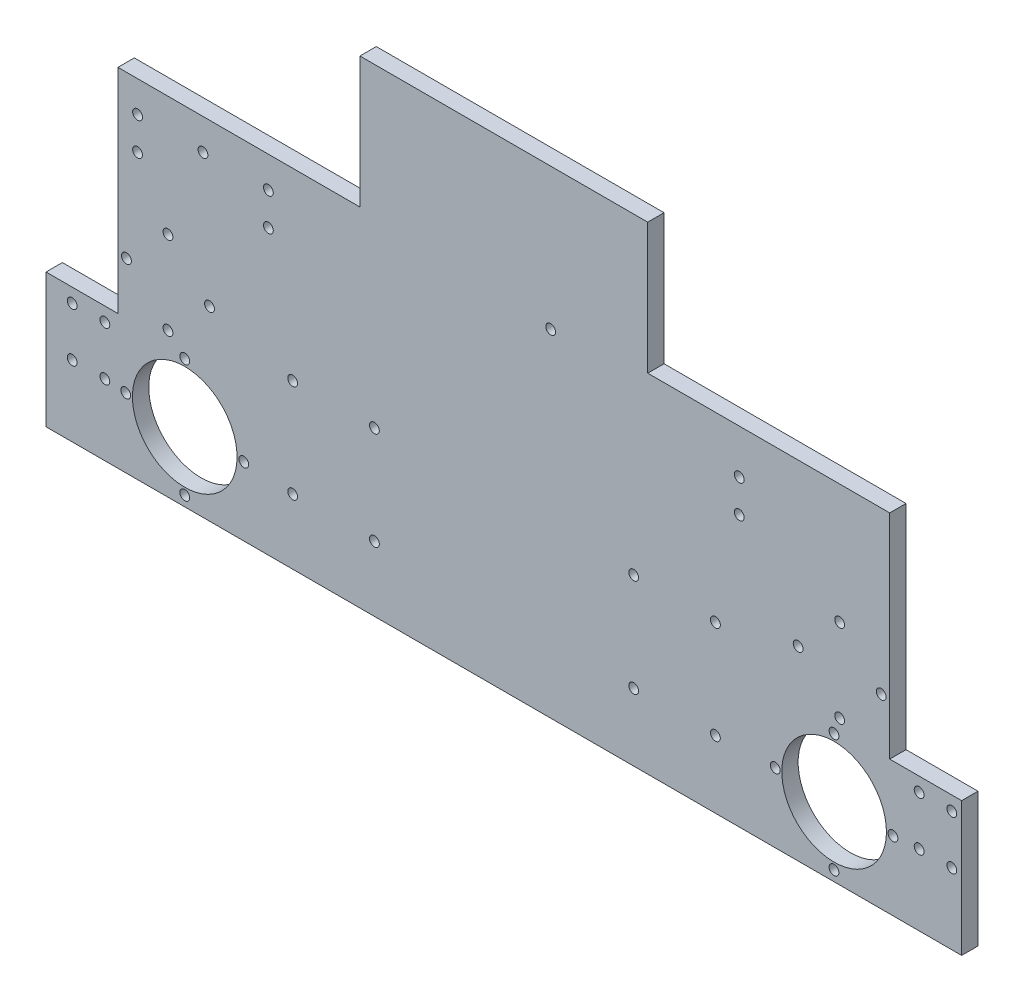
from build123d import *

# Parameters (mm, degrees)
BOSS_EXTRU_2_DEPTH       = 5
ESQUISSE2_R              = 1.5
ENL_V_MAT_EXTRU_1_DEPTH  = 14
ESQUISSE3_R              = 1.5
ENL_V_MAT_EXTRU_2_DEPTH  = 32
ESQUISSE4_R              = 1.5
ENL_V_MAT_EXTRU_3_DEPTH  = 293.72553698
ESQUISSE5_R              = 1.500580152
ENL_V_MAT_EXTRU_4_DEPTH  = 293.72553698
ESQUISSE6_R              = 1.5
ENL_V_MAT_EXTRU_5_DEPTH  = 293.72553698
ESQUISSE7_R              = 1.5
ENL_V_MAT_EXTRU_6_DEPTH  = 293.72553698
ESQUISSE8_W              = 88
ESQUISSE8_H              = 33
ENL_V_MAT_EXTRU_7_DEPTH  = 293.72553698
ESQUISSE9_R              = 1.5
ESQUISSE9_R_2            = 1.507357215
ENL_V_MAT_EXTRU_8_DEPTH  = 279.668333328
ESQUISSE10_W             = 280
ESQUISSE10_H             = 4
BOSS_EXTRU_3_DEPTH       = 5
ESQUISSE12_R             = 16
ENL_V_MAT_EXTRU_10_DEPTH = 279.668333328
ESQUISSE13_R             = 1.5
ENL_V_MAT_EXTRU_11_DEPTH = 279.668333328


with BuildPart() as part:
    # Esquisse1 → Boss.-Extru.2 (new body)
    with BuildSketch(Plane.XY):
        Polygon((-22, -37), (258, -37), (258, 0), (236, 0), (236, 65.2), (162, 65.2), (162, 138.2), (74, 138.2), (74, 65.2), (0, 65.2), (0, 0), (-22, 0), align=None)
    extrude(amount=BOSS_EXTRU_2_DEPTH)

    # Esquisse2 → Enlèv. mat.-Extru.1 (cut)
    with BuildSketch(Plane.XY.offset(5)):
        with Locations((26, 55.7)):
            Circle(ESQUISSE2_R)
        with Locations((46, 55.7)):
            Circle(ESQUISSE2_R)
        with Locations((6, 55.7)):
            Circle(ESQUISSE2_R)
        with Locations((6, 45.7)):
            Circle(ESQUISSE2_R)
        with Locations((-4, -4.3)):
            Circle(ESQUISSE2_R)
        with Locations((-14, -4.3)):
            Circle(ESQUISSE2_R)
        with Locations((-4, -19.3)):
            Circle(ESQUISSE2_R)
        with Locations((-14, -19.3)):
            Circle(ESQUISSE2_R)
    extrude(amount=-ENL_V_MAT_EXTRU_1_DEPTH, mode=Mode.SUBTRACT)

    # Esquisse3 → Enlèv. mat.-Extru.2 (cut)
    with BuildSketch(Plane.XY.offset(5)):
        with Locations((132.331204837, 62.002269793)):
            Circle(ESQUISSE3_R)
    extrude(amount=-ENL_V_MAT_EXTRU_2_DEPTH, mode=Mode.SUBTRACT)

    # Esquisse4 → Enlèv. mat.-Extru.3 (cut, through all)
    with BuildSketch(Plane(origin=(0, 0, 0), x_dir=(-1, 0, 0), z_dir=(0, 0, -1))):
        with Locations((-190, 51.7)):
            Circle(ESQUISSE4_R)
        with Locations((-190, 41.7)):
            Circle(ESQUISSE4_R)
    extrude(amount=-ENL_V_MAT_EXTRU_3_DEPTH, mode=Mode.SUBTRACT)

    # Esquisse5 → Enlèv. mat.-Extru.4 (cut, through all)
    with BuildSketch(Plane.XY.offset(5)):
        with Locations((46, 45.7)):
            Circle(ESQUISSE5_R)
    extrude(amount=-ENL_V_MAT_EXTRU_4_DEPTH, mode=Mode.SUBTRACT)

    # Esquisse6 → Enlèv. mat.-Extru.5 (cut, through all)
    with BuildSketch(Plane.XY.offset(5)):
        with Locations((245, -4.3)):
            Circle(ESQUISSE6_R)
        with Locations((255, -4.3)):
            Circle(ESQUISSE6_R)
        with Locations((255, -19.3)):
            Circle(ESQUISSE6_R)
        with Locations((245, -19.3)):
            Circle(ESQUISSE6_R)
    extrude(amount=-ENL_V_MAT_EXTRU_5_DEPTH, mode=Mode.SUBTRACT)

    # Esquisse7 → Enlèv. mat.-Extru.6 (cut, through all)
    with BuildSketch(Plane(origin=(0, 0, 0), x_dir=(-1, 0, 0), z_dir=(0, 0, -1))):
        with Locations((-15.3, 28.6)):
            Circle(ESQUISSE7_R)
        with Locations((-2.6, 15.9)):
            Circle(ESQUISSE7_R)
        with Locations((-15.3, 3.2)):
            Circle(ESQUISSE7_R)
        with Locations((-28, 15.9)):
            Circle(ESQUISSE7_R)
        with Locations((-208, 15.9)):
            Circle(ESQUISSE7_R)
        with Locations((-220.7, 3.2)):
            Circle(ESQUISSE7_R)
        with Locations((-233.4, 15.9)):
            Circle(ESQUISSE7_R)
        with Locations((-220.7, 28.6)):
            Circle(ESQUISSE7_R)
    extrude(amount=-ENL_V_MAT_EXTRU_6_DEPTH, mode=Mode.SUBTRACT)

    # Esquisse8 → Enlèv. mat.-Extru.7 (cut, through all)
    with BuildSketch(Plane.XY.offset(5)):
        with Locations((118, 121.7)):
            Rectangle(ESQUISSE8_W, ESQUISSE8_H)
    extrude(amount=-ENL_V_MAT_EXTRU_7_DEPTH, mode=Mode.SUBTRACT)

    # Esquisse9 → Enlèv. mat.-Extru.8 (cut, through all)
    with BuildSketch(Plane.XY.offset(5)):
        with Locations((182.7, -20.4)):
            Circle(ESQUISSE9_R)
        with Locations((157.7, -20.4)):
            Circle(ESQUISSE9_R)
        with Locations((157.7, 9.6)):
            Circle(ESQUISSE9_R)
        with Locations((182.7, 9.6)):
            Circle(ESQUISSE9_R_2)
        with Locations((78.424217253, -21.095134328)):
            Circle(ESQUISSE9_R)
        with Locations((53.424217253, -21.095134328)):
            Circle(ESQUISSE9_R)
        with Locations((78.424217253, 8.904865672)):
            Circle(ESQUISSE9_R)
        with Locations((53.424217253, 8.904865672)):
            Circle(ESQUISSE9_R)
    extrude(amount=-ENL_V_MAT_EXTRU_8_DEPTH, mode=Mode.SUBTRACT)

    # Esquisse10 → Boss.-Extru.3 (add)
    with BuildSketch(Plane.XY.offset(5)):
        with Locations((118, -39)):
            Rectangle(ESQUISSE10_W, ESQUISSE10_H)
    extrude(amount=-BOSS_EXTRU_3_DEPTH)

    # Esquisse12 → Enlèv. mat.-Extru.10 (cut, through all)
    with BuildSketch(Plane.XY.offset(5)):
        with Locations((20.424217253, -19.8)):
            Circle(ESQUISSE12_R)
        with Locations((219, -19.8)):
            Circle(ESQUISSE12_R)
    extrude(amount=-ENL_V_MAT_EXTRU_10_DEPTH, mode=Mode.SUBTRACT)

    # Esquisse13 → Enlèv. mat.-Extru.11 (cut, through all)
    with BuildSketch(Plane.XY.offset(5)):
        with Locations((2.383457441, -19.8)):
            Circle(ESQUISSE13_R)
        with Locations((20.424217253, -1.741178451)):
            Circle(ESQUISSE13_R)
        with Locations((38.478848473, -20.040125082)):
            Circle(ESQUISSE13_R)
        with Locations((20.424217253, -37.870789792)):
            Circle(ESQUISSE13_R)
        with Locations((218.965275761, -1.741178451)):
            Circle(ESQUISSE13_R)
        with Locations((236.986339902, -19.8)):
            Circle(ESQUISSE13_R)
        with Locations((200.994611176, -19.8)):
            Circle(ESQUISSE13_R)
        with Locations((218.965275761, -37.870789792)):
            Circle(ESQUISSE13_R)
    extrude(amount=-ENL_V_MAT_EXTRU_11_DEPTH, mode=Mode.SUBTRACT)


solid = part.part
